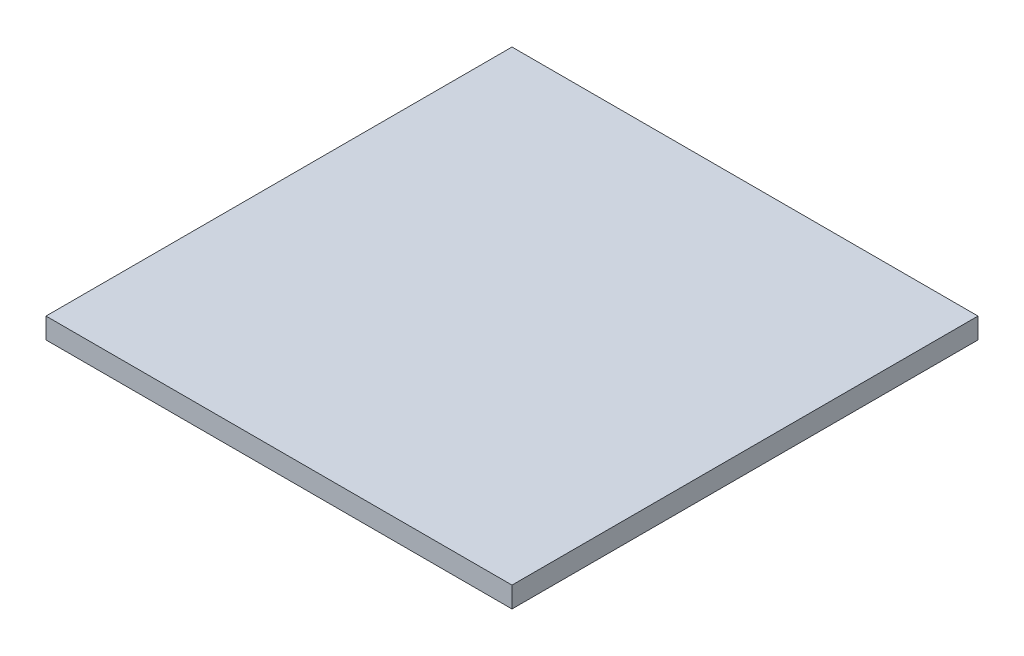
from build123d import *

# Parameters (mm, degrees)
SKETCH1_W           = 571.5
SKETCH1_H           = 571.5
BOSS_EXTRUDE1_DEPTH = 25.4


with BuildPart() as part:
    # Sketch1 → Boss-Extrude1 (new body)
    with BuildSketch(Plane(origin=(0, 0, 0), x_dir=(1, 0, 0), z_dir=(0, 1, 0))):
        with Locations((-285.75, 285.75)):
            Rectangle(SKETCH1_W, SKETCH1_H)
    extrude(amount=BOSS_EXTRUDE1_DEPTH)


solid = part.part
